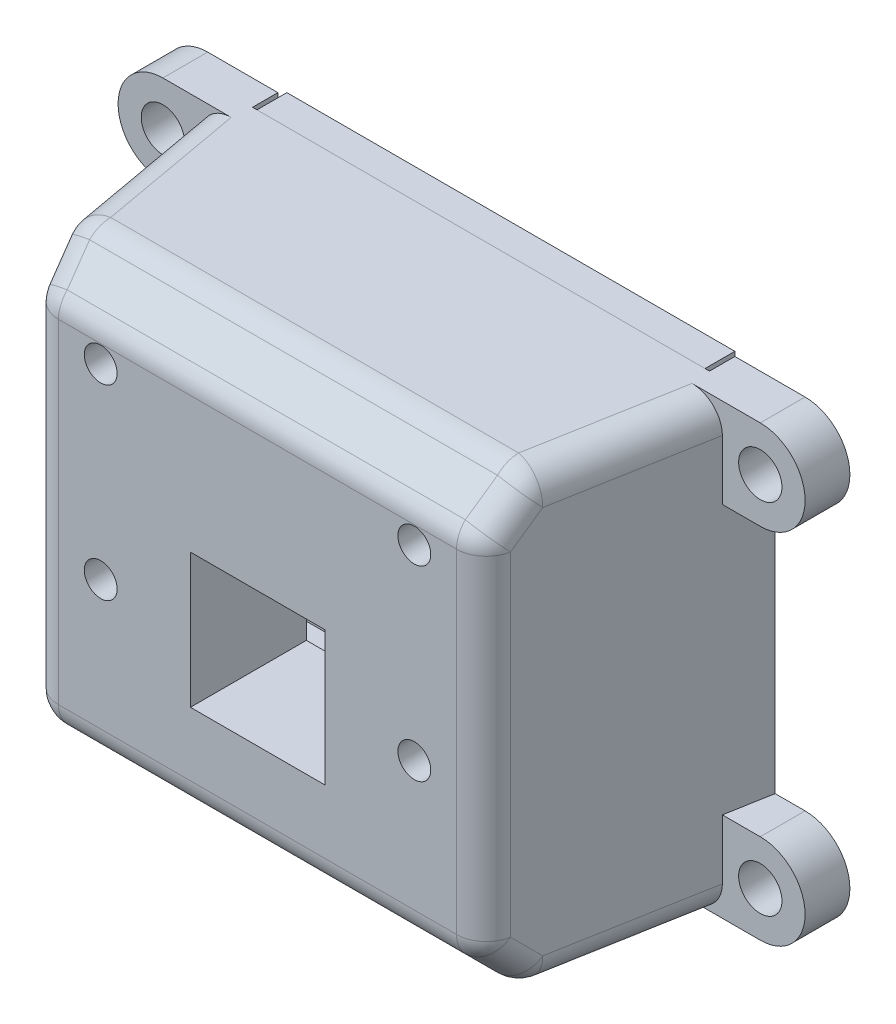
from build123d import *

# Parameters (mm, degrees)
SKETCH1_W                       = 30
SKETCH1_H                       = 30
BOSS_EXTRUDE1_DEPTH             = 2
BOSS_EXTRUDE2_DEPTH             = 12.962999868
BOSS_EXTRUDE3_DEPTH             = 5.762999868
SKETCH4_W                       = 26
SKETCH4_H                       = 2.633310891
BOSS_EXTRUDE4_DEPTH             = 6.762999868
SKETCH6_W                       = 30
SKETCH6_H                       = 30
BOSS_EXTRUDE5_DEPTH             = 2
SKETCH8_W                       = 9
SKETCH8_H                       = 9
CUT_EXTRUDE1_DEPTH              = 28.161431562
SKETCH9_W                       = 11
SKETCH9_H                       = 11
SKETCH9_W_2                     = 9
SKETCH9_H_2                     = 9
BOSS_EXTRUDE7_DEPTH             = 5.763
SKETCH10_W                      = 9
SKETCH10_H                      = 1
CUT_EXTRUDE2_DEPTH              = 2.1
SKETCH11_W                      = 26
SKETCH11_H                      = 0.001
BOSS_EXTRUDE8_DEPTH             = 12.962999868
SKETCH13_W                      = 0.75
SKETCH13_H                      = 6.2
CUT_EXTRUDE3_DEPTH              = 27.999
SKETCH7_W                       = 27
SKETCH7_H                       = 5.95
BOSS_EXTRUDE6_DEPTH             = 2
SKETCH12_W                      = 1
SKETCH12_H                      = 5.95
BOSS_EXTRUDE10_DEPTH            = 27.999
BOSS_EXTRUDE12_DEPTH            = 30
BOSS_EXTRUDE13_DEPTH            = 3
SKETCH21_W                      = 1.45
SKETCH21_H                      = 3.3
M2_5_CLEARANCE_HOLE1_AT_2_COUNT = 2
M2_5_CLEARANCE_HOLE1_AT_2_PITCH = 40
M2_5_CLEARANCE_HOLE1_AT_3_COUNT = 2
M2_5_CLEARANCE_HOLE1_AT_3_PITCH = 46.647615159
M2_5_CLEARANCE_HOLE1_AT_4_COUNT = 2
M2_5_CLEARANCE_HOLE1_AT_4_PITCH = 24
CHAMFER1_SIZE                   = 3
SKETCH22_W                      = 18.301416056
SKETCH22_H                      = 1.65
CUT_EXTRUDE5_DEPTH              = 2
SKETCH25_W                      = 1.1
SKETCH25_H                      = 7.762999868
M2_CLEARANCE_HOLE1_AT_2_COUNT   = 2
M2_CLEARANCE_HOLE1_AT_2_PITCH   = 21
M2_CLEARANCE_HOLE1_AT_3_COUNT   = 2
M2_CLEARANCE_HOLE1_AT_3_PITCH   = 24.43869882
M2_CLEARANCE_HOLE1_AT_4_COUNT   = 2
M2_CLEARANCE_HOLE1_AT_4_PITCH   = 12.5
CHAMFER2_SIZE                   = 0.5
FILLET1_R                       = 2


with BuildPart() as part:
    # Sketch1 → Boss-Extrude1 (new body)
    with BuildSketch(Plane.XY.offset(6.762999868)):
        Rectangle(SKETCH1_W, SKETCH1_H)
    extrude(amount=BOSS_EXTRUDE1_DEPTH)

    # Sketch2 → Boss-Extrude2 (add)
    with BuildSketch(Plane(origin=(0, 0, 6.762999868), x_dir=(-1, 0, 0), z_dir=(0, 0, -1))):
        Polygon((13, -15), (13, 13), (-13, 13), (-13, -15), (-15, -15), (-15, 15), (15, 15), (15, -15), align=None)
    extrude(amount=BOSS_EXTRUDE2_DEPTH)

    # Sketch3 → Boss-Extrude3 (add)
    with BuildSketch(Plane(origin=(0, 0, 6.762999868), x_dir=(-1, 0, 0), z_dir=(0, 0, -1))):
        with BuildLine():
            Line((-10.5, 0.495310891), (-13, 0.495310891))
            Line((-13, 0.495310891), (-13, -5.504689109))
            Line((-13, -5.504689109), (-10.5, -5.504689109))
            ThreePointArc((-10.5, -5.504689109), (-7.5, -2.504689109), (-10.5, 0.495310891))
        make_face()
        with BuildLine():
            Line((-13, 12.995310891), (-10.5, 12.995310891))
            ThreePointArc((-10.5, 12.995310891), (-7.5, 9.995310891), (-10.5, 6.995310891))
            Line((-10.5, 6.995310891), (-13, 6.995310891))
            Line((-13, 6.995310891), (-13, 12.995310891))
        make_face()
        with BuildLine():
            Line((13, 12.995310891), (10.5, 12.995310891))
            ThreePointArc((10.5, 12.995310891), (7.5, 9.995310891), (10.5, 6.995310891))
            Line((10.5, 6.995310891), (13, 6.995310891))
            Line((13, 6.995310891), (13, 12.995310891))
        make_face()
        with BuildLine():
            Line((13, 0.495310891), (10.5, 0.495310891))
            ThreePointArc((10.5, 0.495310891), (7.5, -2.504689109), (10.5, -5.504689109))
            Line((10.5, -5.504689109), (13, -5.504689109))
            Line((13, -5.504689109), (13, 0.495310891))
        make_face()
    extrude(amount=BOSS_EXTRUDE3_DEPTH)

    # Sketch4 → Boss-Extrude4 (add)
    with BuildSketch(Plane(origin=(0, 0, 6.762999868), x_dir=(-1, 0, 0), z_dir=(0, 0, -1))):
        with Locations((0, -13.683344555)):
            Rectangle(SKETCH4_W, SKETCH4_H)
    extrude(amount=BOSS_EXTRUDE4_DEPTH)

    # Sketch8 → Cut-Extrude1 (cut, through all)
    with BuildSketch(Plane.XY.offset(8.762999868)):
        with Locations((0.008321586, -2.407784624)):
            Rectangle(SKETCH8_W, SKETCH8_H)
    extrude(amount=-CUT_EXTRUDE1_DEPTH, mode=Mode.SUBTRACT)

    # Sketch9 → Boss-Extrude7 (add)
    with BuildSketch(Plane(origin=(0, 0, 6.762999868), x_dir=(-1, 0, 0), z_dir=(0, 0, -1))):
        with Locations((-0.008321586, -2.407784624)):
            Rectangle(SKETCH9_W, SKETCH9_H)
        with Locations((-0.008321586, -2.407784624)):
            Rectangle(SKETCH9_W_2, SKETCH9_H_2, mode=Mode.SUBTRACT)
    extrude(amount=BOSS_EXTRUDE7_DEPTH)

    # Sketch10 → Cut-Extrude2 (cut)
    with BuildSketch(Plane(origin=(0, 0, 1), x_dir=(-1, 0, 0), z_dir=(0, 0, -1))):
        with Locations((-0.008321586, 2.592215376)):
            Rectangle(SKETCH10_W, SKETCH10_H)
    extrude(amount=-CUT_EXTRUDE2_DEPTH, mode=Mode.SUBTRACT)

    # Sketch11 → Boss-Extrude8 (add)
    with BuildSketch(Plane(origin=(0, 0, 6.762999868), x_dir=(-1, 0, 0), z_dir=(0, 0, -1))):
        with Locations((0, 12.9995)):
            Rectangle(SKETCH11_W, SKETCH11_H)
    extrude(amount=BOSS_EXTRUDE8_DEPTH)

    # Sketch13 → Cut-Extrude3 (cut)
    with BuildSketch(Plane.XZ.offset(15)):
        with Locations((13.375, -3.1)):
            Rectangle(SKETCH13_W, SKETCH13_H)
        with Locations((-13.375, -3.1)):
            Rectangle(SKETCH13_W, SKETCH13_H)
    extrude(amount=-CUT_EXTRUDE3_DEPTH, mode=Mode.SUBTRACT)

    # Sketch17 → Boss-Extrude12 (add)
    with BuildSketch(Plane.XZ.offset(15)):
        Polygon((15, 8.762999868), (18, -7.9), (15.3, -7.9), (15.3, -6.2), (15, -6.2), align=None)
        Polygon((-15.3, -6.2), (-15, -6.2), (-15, 8.762999868), (-18, -7.9), (-15.3, -7.9), align=None)
    extrude(amount=-BOSS_EXTRUDE12_DEPTH)

    # Sketch19 → Boss-Extrude13 (add)
    with BuildSketch(Plane(origin=(0, 0, -7.9), x_dir=(-1, 0, 0), z_dir=(0, 0, -1))):
        with BuildLine():
            Line((-15.3, 15), (-20, 15))
            ThreePointArc((-20, 15), (-23, 12), (-20, 9))
            Line((-20, 9), (-15.3, 9))
            Line((-15.3, 9), (-15.3, 15))
        make_face()
        with BuildLine():
            Line((15.3, 15), (20, 15))
            ThreePointArc((20, 15), (23, 12), (20, 9))
            Line((20, 9), (15.3, 9))
            Line((15.3, 9), (15.3, 15))
        make_face()
        with BuildLine():
            Line((-15.3, -15), (-20, -15))
            ThreePointArc((-20, -15), (-23, -12), (-20, -9))
            Line((-20, -9), (-15.3, -9))
            Line((-15.3, -9), (-15.3, -15))
        make_face()
        with BuildLine():
            Line((15.3, -15), (20, -15))
            ThreePointArc((20, -15), (23, -12), (20, -9))
            Line((20, -9), (15.3, -9))
            Line((15.3, -9), (15.3, -15))
        make_face()
    extrude(amount=-BOSS_EXTRUDE13_DEPTH)

    # Sketch21 → M2.5 Clearance Hole1 (revolve, cut)
    with BuildSketch(Plane(origin=(-20, 12, -4.9), x_dir=(0, -1, 0), z_dir=(1, 0, 0))):
        with Locations((0.725, 1.65)):
            Rectangle(SKETCH21_W, SKETCH21_H)
    m2_5_clearance_hole1 = revolve(axis=Axis((-20, 12, 1.45), (0, 0, -1)), mode=Mode.SUBTRACT)

    # M2.5 Clearance Hole1 at 2: M2.5 Clearance Hole1 ×2
    with Locations(*[(i * M2_5_CLEARANCE_HOLE1_AT_2_PITCH, 0, 0) for i in range(1, M2_5_CLEARANCE_HOLE1_AT_2_COUNT)]):
        add(m2_5_clearance_hole1, mode=Mode.SUBTRACT)

    # M2.5 Clearance Hole1 at 3: M2.5 Clearance Hole1 ×2
    with Locations(*[Vector(0.8574929257125442, -0.5144957554275266, 0) * (i * M2_5_CLEARANCE_HOLE1_AT_3_PITCH) for i in range(1, M2_5_CLEARANCE_HOLE1_AT_3_COUNT)]):
        add(m2_5_clearance_hole1, mode=Mode.SUBTRACT)

    # M2.5 Clearance Hole1 at 4: M2.5 Clearance Hole1 ×2
    with Locations(*[(0, -i * M2_5_CLEARANCE_HOLE1_AT_4_PITCH, 0) for i in range(1, M2_5_CLEARANCE_HOLE1_AT_4_COUNT)]):
        add(m2_5_clearance_hole1, mode=Mode.SUBTRACT)

    # Chamfer1
    chamfer1_edges = [part.edges().sort_by_distance(p)[0] for p in [
        (0, -15, 8.762999868),
        (0, 15, 8.762999868),
    ]]
    chamfer(chamfer1_edges, length=CHAMFER1_SIZE)

    # Sketch25 → M2 Clearance Hole1 (revolve, cut)
    with BuildSketch(Plane(origin=(10.5, 9.995310891, 1), x_dir=(0, 1, 0), z_dir=(1, 0, 0))):
        with Locations((0.55, 3.881499934)):
            Rectangle(SKETCH25_W, SKETCH25_H)
    m2_clearance_hole1 = revolve(axis=Axis((10.5, 9.995310891, -5.35), (0, 0, 1)), mode=Mode.SUBTRACT)

    # M2 Clearance Hole1 at 2: M2 Clearance Hole1 ×2
    with Locations(*[(-i * M2_CLEARANCE_HOLE1_AT_2_PITCH, 0, 0) for i in range(1, M2_CLEARANCE_HOLE1_AT_2_COUNT)]):
        add(m2_clearance_hole1, mode=Mode.SUBTRACT)

    # M2 Clearance Hole1 at 3: M2 Clearance Hole1 ×2
    with Locations(*[Vector(-0.8592928844097062, -0.5114838597676834, 0) * (i * M2_CLEARANCE_HOLE1_AT_3_PITCH) for i in range(1, M2_CLEARANCE_HOLE1_AT_3_COUNT)]):
        add(m2_clearance_hole1, mode=Mode.SUBTRACT)

    # M2 Clearance Hole1 at 4: M2 Clearance Hole1 ×2
    with Locations(*[(0, -i * M2_CLEARANCE_HOLE1_AT_4_PITCH, 0) for i in range(1, M2_CLEARANCE_HOLE1_AT_4_COUNT)]):
        add(m2_clearance_hole1, mode=Mode.SUBTRACT)

    # Chamfer2
    chamfer2_edges = [part.edges().sort_by_distance(p)[0] for p in [
        (10.5, -3.604689109, 1),
        (-10.5, -3.604689109, 1),
        (-10.5, 8.895310891, 1),
        (10.5, 8.895310891, 1),
    ]]
    chamfer(chamfer2_edges, length=CHAMFER2_SIZE)

    # Fillet1
    fillet1_edges = [part.edges().sort_by_distance(p)[0] for p in [
        (-16.5, 15, 0.431499934),
        (16.5, -15, 0.431499934),
        (15, 0, 8.762999868),
        (-15, 0, 8.762999868),
        (0, -12, 8.762999868),
        (0, 12, 8.762999868),
        (-16.5, -15, 0.431499934),
        (-15.270059415, -13.5, 7.262999868),
        (-15.270059415, 13.5, 7.262999868),
        (16.5, 15, 0.431499934),
        (0, 15, 5.762999868),
        (15.270059415, -13.5, 7.262999868),
        (15.270059415, 13.5, 7.262999868),
        (0, -15, 5.762999868),
    ]]
    fillet(fillet1_edges, radius=FILLET1_R)


with BuildPart() as body_2:
    # Sketch6 → Boss-Extrude5 (new body)
    with BuildSketch(Plane(origin=(0, 0, -6.2), x_dir=(-1, 0, 0), z_dir=(0, 0, -1))):
        Rectangle(SKETCH6_W, SKETCH6_H)
    extrude(amount=BOSS_EXTRUDE5_DEPTH)

    # Sketch7 → Boss-Extrude6 (add)
    with BuildSketch(Plane.XZ.offset(15)):
        with Locations((0, -3.225)):
            Rectangle(SKETCH7_W, SKETCH7_H)
    extrude(amount=-BOSS_EXTRUDE6_DEPTH)

    # Sketch12 → Boss-Extrude10 (add)
    with BuildSketch(Plane.XZ.offset(15)):
        with Locations((-13, -3.225)):
            Rectangle(SKETCH12_W, SKETCH12_H)
        with Locations((13, -3.225)):
            Rectangle(SKETCH12_W, SKETCH12_H)
    extrude(amount=-BOSS_EXTRUDE10_DEPTH)

    # Sketch22 → Cut-Extrude5 (cut)
    with BuildSketch(Plane.XZ.offset(15)):
        with Locations((0, -1.075)):
            Rectangle(SKETCH22_W, SKETCH22_H)
    extrude(amount=-CUT_EXTRUDE5_DEPTH, mode=Mode.SUBTRACT)


solid = Compound([part.part, body_2.part])
